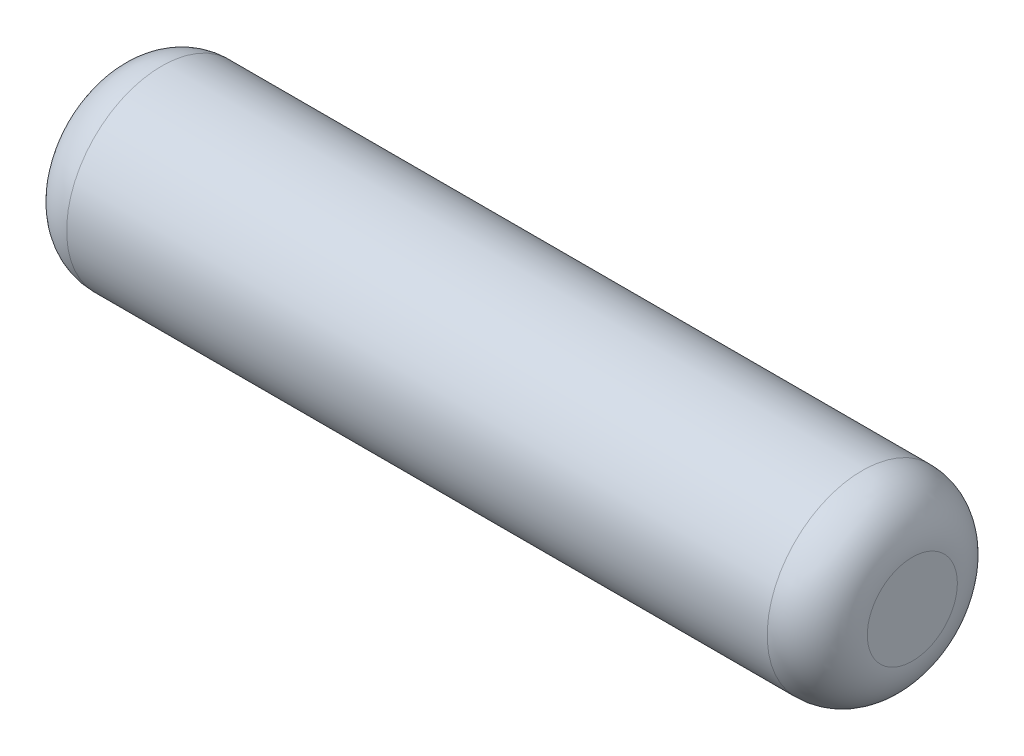
from build123d import *

# Parameters (mm, degrees)
SKETCH1_R           = 48.26
BOSS_EXTRUDE1_DEPTH = 406.4
FILLET1_R           = 25.4


with BuildPart() as part:
    # Sketch1 → Boss-Extrude1 (new body)
    with BuildSketch(Plane(origin=(0, 0, 0), x_dir=(0, 0, -1), z_dir=(1, 0, 0))):
        Circle(SKETCH1_R)
    extrude(amount=BOSS_EXTRUDE1_DEPTH)

    # Fillet1
    fillet1_edges = [part.edges().sort_by_distance(p)[0] for p in [
        (0, 0, 48.26),
        (406.4, 0, 48.26),
    ]]
    fillet(fillet1_edges, radius=FILLET1_R)


solid = part.part
